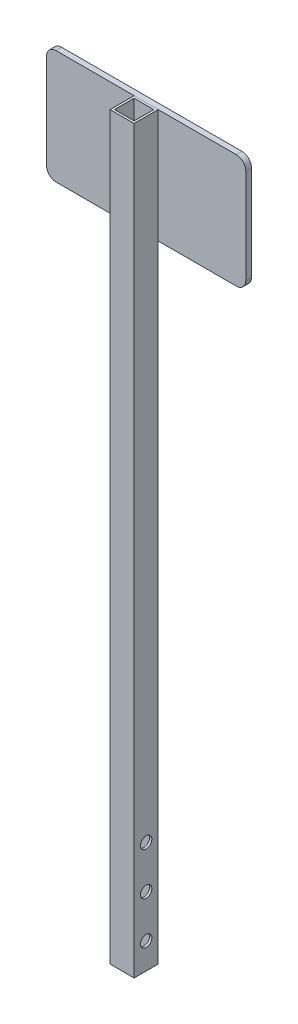
from build123d import *

# Parameters (mm, degrees)
SKETCH1_W               = 12.7
SKETCH1_H               = 390
BOSS_EXTRUDE1_DEPTH     = 6.35
SHELL1_T                = -1.2
CUT_EXTRUDE1_DEPTH      = 391.103377325
CUT_EXTRUDE1_DEPTH_BACK = 391.103377325
SKETCH1_3_R             = 3
BOSS_EXTRUDE2_DEPTH     = 3


with BuildPart() as part:
    # Sketch1 → Boss-Extrude1 (new, symmetric)
    with BuildSketch(Plane(origin=(0, 0, 0), x_dir=(0, 0, -1), z_dir=(1, 0, 0))):
        with Locations((0, -195)):
            Rectangle(SKETCH1_W, SKETCH1_H)
    extrude(amount=BOSS_EXTRUDE1_DEPTH, both=True)

    # Shell1
    shell1_openings = [part.faces().sort_by_distance(p)[0] for p in [
        (0, 0, 0),
        (0, -390, 0),
    ]]
    offset(amount=SHELL1_T, openings=shell1_openings, kind=Kind.INTERSECTION)

    # Sketch1<3> → Cut-Extrude1 (cut, two sides: drawn at the far end of the back side and taken through both)
    with BuildSketch(Plane(origin=(0, 0, 0), x_dir=(0, 0, -1), z_dir=(1, 0, 0)).offset(-CUT_EXTRUDE1_DEPTH_BACK)):
        with Locations((0, -376.25)):
            Circle(SKETCH1_3_R)
        with Locations((0, -353.75)):
            Circle(SKETCH1_3_R)
        with Locations((0, -331.25)):
            Circle(SKETCH1_3_R)
    extrude(amount=CUT_EXTRUDE1_DEPTH + CUT_EXTRUDE1_DEPTH_BACK, mode=Mode.SUBTRACT)


with BuildPart() as body_2:
    # Sketch2 → Boss-Extrude2 (new body)
    with BuildSketch(Plane(origin=(0, 0, -6.35), x_dir=(-1, 0, 0), z_dir=(0, 0, -1))):
        with BuildLine():
            Line((-47.5, -60), (47.5, -60))
            ThreePointArc((47.5, -60), (51.035533906, -58.535533906), (52.5, -55))
            Line((52.5, -55), (52.5, -5))
            ThreePointArc((52.5, -5), (51.035533906, -1.464466094), (47.5, 0))
            Line((47.5, 0), (-47.5, 0))
            ThreePointArc((-47.5, 0), (-51.035533906, -1.464466094), (-52.5, -5))
            Line((-52.5, -5), (-52.5, -55))
            ThreePointArc((-52.5, -55), (-51.035533906, -58.535533906), (-47.5, -60))
        make_face()
    extrude(amount=BOSS_EXTRUDE2_DEPTH)


solid = Compound([part.part, body_2.part])
